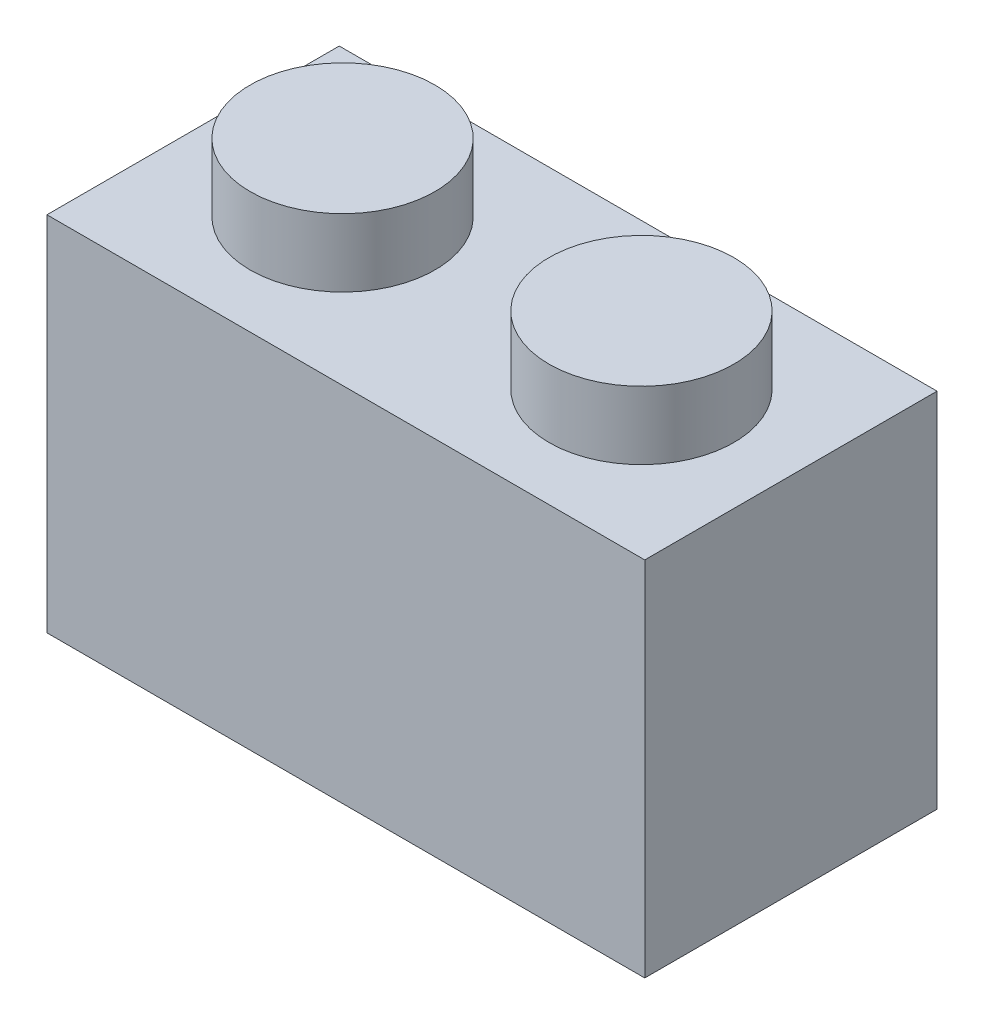
from build123d import *

# Parameters (mm, degrees)
SKETCH1_W           = 15.85
SKETCH1_H           = 7.75
BOSS_EXTRUDE1_DEPTH = 9.6
SKETCH2_R           = 2.45
BOSS_EXTRUDE2_DEPTH = 1.8
SHELL1_T            = -1.5


with BuildPart() as part:
    # Sketch1 → Boss-Extrude1 (new body)
    with BuildSketch(Plane(origin=(0, 0, 0), x_dir=(1, 0, 0), z_dir=(0, 1, 0))):
        Rectangle(SKETCH1_W, SKETCH1_H)
    extrude(amount=-BOSS_EXTRUDE1_DEPTH)

    # Sketch2 → Boss-Extrude2 (add)
    with BuildSketch(Plane(origin=(0, 0, 0), x_dir=(1, 0, 0), z_dir=(0, 1, 0))):
        with Locations(Location((-3.9625, 0, 0), (0, 0, 270))):
            Circle(SKETCH2_R)
        with Locations(Location((3.9625, 0, 0), (0, 0, 90))):
            Circle(SKETCH2_R)
    extrude(amount=BOSS_EXTRUDE2_DEPTH)

    # Shell1
    shell1_openings = [part.faces().sort_by_distance(p)[0] for p in [
        (0, -9.6, 0),
    ]]
    offset(amount=SHELL1_T, openings=shell1_openings, kind=Kind.INTERSECTION)


solid = part.part
